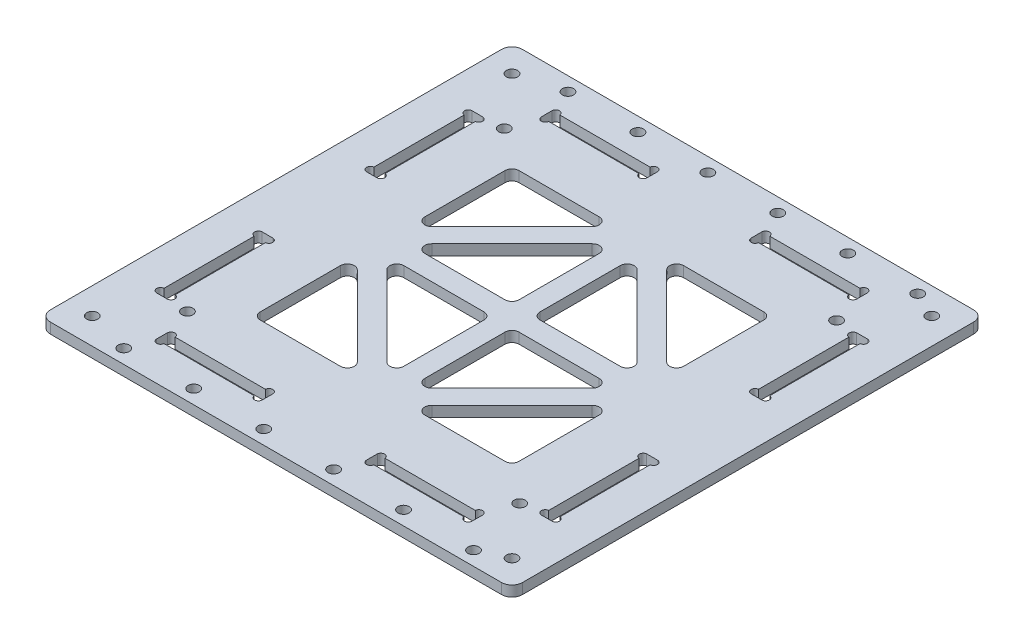
from build123d import *

# Parameters (mm, degrees)
SKETCH_1_W                         = 135
SKETCH_1_H                         = 135
SKETCH_1_R                         = 1.6
EXTRUDE_1_DEPTH                    = 3
SKETCH_2_R                         = 1.100315487
SKETCH_2_W                         = 30.2
SKETCH_2_H                         = 3.2
CUT_EXTRUDE_1_DEPTH                = 10
PATTERN_CIRCULAR_1_COUNT           = 4
PATTERN_CIRCULAR_1_COPY_1_SKETCH_R = 1.100315487
PATTERN_CIRCULAR_1_COPY_1_SKETCH_W = 30.2
PATTERN_CIRCULAR_1_COPY_1_SKETCH_H = 3.2
PATTERN_CIRCULAR_1_COPY_1_DEPTH    = 10
PATTERN_CIRCULAR_1_COPY_2_SKETCH_R = 1.100315487
PATTERN_CIRCULAR_1_COPY_2_SKETCH_W = 30.2
PATTERN_CIRCULAR_1_COPY_2_SKETCH_H = 3.2
PATTERN_CIRCULAR_1_COPY_2_DEPTH    = 10
PATTERN_CIRCULAR_1_COPY_3_SKETCH_R = 1.100315487
PATTERN_CIRCULAR_1_COPY_3_SKETCH_W = 30.2
PATTERN_CIRCULAR_1_COPY_3_SKETCH_H = 3.2
PATTERN_CIRCULAR_1_COPY_3_DEPTH    = 10
SKETCH_4_R                         = 1.6
CUT_EXTRUDE_2_DEPTH                = 10
FILLET_1_R                         = 3
CUT_EXTRUDE_3_DEPTH                = 10
FILLET_2_R                         = 2
SKETCH_6_R                         = 1.6
CUT_EXTRUDE_4_DEPTH                = 10


with BuildPart() as part:
    # 草图1 → 凸台-拉伸1 (new body)
    with BuildSketch(Plane(origin=(0, 0, 0), x_dir=(1, 0, 0), z_dir=(0, 1, 0))):
        Rectangle(SKETCH_1_W, SKETCH_1_H)
        with Locations(Location((-47.5, 45.3, 0), (0, 0, 270))):
            Circle(SKETCH_1_R, mode=Mode.SUBTRACT)
        with Locations(Location((47.5, 45.3, 0), (0, 0, 270))):
            Circle(SKETCH_1_R, mode=Mode.SUBTRACT)
        with Locations(Location((47.5, -45.3, 0), (0, 0, 270))):
            Circle(SKETCH_1_R, mode=Mode.SUBTRACT)
        with Locations(Location((-47.5, -45.3, 0), (0, 0, 270))):
            Circle(SKETCH_1_R, mode=Mode.SUBTRACT)
    extrude(amount=EXTRUDE_1_DEPTH)

    # 草图2 → 切除-拉伸1 (cut)
    with BuildSketch(Plane(origin=(0, 3, 0), x_dir=(1, 0, 0), z_dir=(0, 1, 0))):
        with Locations((-16.000315487, 56.5)):
            Circle(SKETCH_2_R)
        with Locations((-16.000315487, 53.5)):
            Circle(SKETCH_2_R)
        with Locations((-43.999684513, 56.5)):
            Circle(SKETCH_2_R)
        with Locations((-43.999684513, 53.5)):
            Circle(SKETCH_2_R)
        with Locations((-30, 55)):
            Rectangle(SKETCH_2_W, SKETCH_2_H)
    cut_extrude_1 = extrude(amount=-CUT_EXTRUDE_1_DEPTH, mode=Mode.SUBTRACT)

    # 镜向1: 切除-拉伸1 across plane
    add(cut_extrude_1.mirror(Plane(origin=(0, 0, 0), x_dir=(0, 0, 1), z_dir=(1, 0, 0))), mode=Mode.SUBTRACT)

    # 阵列(圆周)1: 切除-拉伸1 ×4 about axis
    pattern_circular_1_axis = Axis((0, 0, 0), (0, 1, 0))
    for i in range(1, PATTERN_CIRCULAR_1_COUNT):
        add(cut_extrude_1.rotate(pattern_circular_1_axis, i * 360 / PATTERN_CIRCULAR_1_COUNT), mode=Mode.SUBTRACT)

    # 阵列(圆周)1 copy 1 sketch → 阵列(圆周)1 copy 1 (cut)
    with BuildSketch(Plane.ZX.offset(3)):
        with Locations((-16.000315487, -56.5)):
            Circle(PATTERN_CIRCULAR_1_COPY_1_SKETCH_R)
        with Locations((-16.000315487, -53.5)):
            Circle(PATTERN_CIRCULAR_1_COPY_1_SKETCH_R)
        with Locations((-43.999684513, -56.5)):
            Circle(PATTERN_CIRCULAR_1_COPY_1_SKETCH_R)
        with Locations((-43.999684513, -53.5)):
            Circle(PATTERN_CIRCULAR_1_COPY_1_SKETCH_R)
        with Locations((-30, -55)):
            Rectangle(PATTERN_CIRCULAR_1_COPY_1_SKETCH_W, PATTERN_CIRCULAR_1_COPY_1_SKETCH_H)
    extrude(amount=-PATTERN_CIRCULAR_1_COPY_1_DEPTH, mode=Mode.SUBTRACT)

    # 阵列(圆周)1 copy 2 sketch → 阵列(圆周)1 copy 2 (cut)
    with BuildSketch(Plane(origin=(0, 3, 0), x_dir=(1, 0, 0), z_dir=(0, 1, 0))):
        with Locations((-16.000315487, -56.5)):
            Circle(PATTERN_CIRCULAR_1_COPY_2_SKETCH_R)
        with Locations((-16.000315487, -53.5)):
            Circle(PATTERN_CIRCULAR_1_COPY_2_SKETCH_R)
        with Locations((-43.999684513, -56.5)):
            Circle(PATTERN_CIRCULAR_1_COPY_2_SKETCH_R)
        with Locations((-43.999684513, -53.5)):
            Circle(PATTERN_CIRCULAR_1_COPY_2_SKETCH_R)
        with Locations((-30, -55)):
            Rectangle(PATTERN_CIRCULAR_1_COPY_2_SKETCH_W, PATTERN_CIRCULAR_1_COPY_2_SKETCH_H)
    extrude(amount=-PATTERN_CIRCULAR_1_COPY_2_DEPTH, mode=Mode.SUBTRACT)

    # 阵列(圆周)1 copy 3 sketch → 阵列(圆周)1 copy 3 (cut)
    with BuildSketch(Plane(origin=(0, 3, 0), x_dir=(0, 0, -1), z_dir=(0, 1, 0))):
        with Locations((-16.000315487, -56.5)):
            Circle(PATTERN_CIRCULAR_1_COPY_3_SKETCH_R)
        with Locations((-16.000315487, -53.5)):
            Circle(PATTERN_CIRCULAR_1_COPY_3_SKETCH_R)
        with Locations((-43.999684513, -56.5)):
            Circle(PATTERN_CIRCULAR_1_COPY_3_SKETCH_R)
        with Locations((-43.999684513, -53.5)):
            Circle(PATTERN_CIRCULAR_1_COPY_3_SKETCH_R)
        with Locations((-30, -55)):
            Rectangle(PATTERN_CIRCULAR_1_COPY_3_SKETCH_W, PATTERN_CIRCULAR_1_COPY_3_SKETCH_H)
    extrude(amount=-PATTERN_CIRCULAR_1_COPY_3_DEPTH, mode=Mode.SUBTRACT)

    # 草图4 → 切除-拉伸2 (cut)
    with BuildSketch(Plane(origin=(0, 3, 0), x_dir=(1, 0, 0), z_dir=(0, 1, 0))):
        with Locations(Location((-60, 60, 0), (0, 0, 270))):
            Circle(SKETCH_4_R)
        with Locations(Location((60, 60, 0), (0, 0, 270))):
            Circle(SKETCH_4_R)
        with Locations(Location((60, -60, 0), (0, 0, 270))):
            Circle(SKETCH_4_R)
        with Locations(Location((-60, -60, 0), (0, 0, 270))):
            Circle(SKETCH_4_R)
    extrude(amount=-CUT_EXTRUDE_2_DEPTH, mode=Mode.SUBTRACT)

    # 圆角1
    fillet_1_edges = [part.edges().sort_by_distance(p)[0] for p in [
        (67.5, 1.5, 67.5),
        (-67.5, 1.5, 67.5),
        (-67.5, 1.5, -67.5),
        (67.5, 1.5, -67.5),
    ]]
    fillet(fillet_1_edges, radius=FILLET_1_R)

    # 草图5 → 切除-拉伸3 (cut)
    with BuildSketch(Plane(origin=(0, 3, 0), x_dir=(1, 0, 0), z_dir=(0, 1, 0))):
        Polygon((-7.242640687, 37), (-37, 37), (-37, 7.242640687), align=None)
        Polygon((-3, 32.757359313), (-32.757359313, 3), (-3, 3), align=None)
        Polygon((7.242640687, 37), (37, 7.242640687), (37, 37), align=None)
        Polygon((3, 32.757359313), (3, 3), (32.757359313, 3), align=None)
        Polygon((-7.242640687, -37), (-37, -7.242640687), (-37, -37), align=None)
        Polygon((-3, -32.757359313), (-3, -3), (-32.757359313, -3), align=None)
        Polygon((7.242640687, -37), (37, -37), (37, -7.242640687), align=None)
        Polygon((3, -32.757359313), (32.757359313, -3), (3, -3), align=None)
    extrude(amount=-CUT_EXTRUDE_3_DEPTH, mode=Mode.SUBTRACT)

    # 圆角2
    fillet_2_edges = [part.edges().sort_by_distance(p)[0] for p in [
        (-3, 1.5, 32.757359313),
        (-32.757359313, 1.5, 3),
        (-3, 1.5, 3),
        (7.242640687, 1.5, -37),
        (37, 1.5, -37),
        (37, 1.5, -7.242640687),
        (-3, 1.5, -32.757359313),
        (-3, 1.5, -3),
        (-32.757359313, 1.5, -3),
        (3, 1.5, -32.757359313),
        (32.757359313, 1.5, -3),
        (3, 1.5, -3),
        (3, 1.5, 32.757359313),
        (3, 1.5, 3),
        (32.757359313, 1.5, 3),
        (7.242640687, 1.5, 37),
        (37, 1.5, 7.242640687),
        (37, 1.5, 37),
        (-7.242640687, 1.5, 37),
        (-37, 1.5, 37),
        (-37, 1.5, 7.242640687),
        (-7.242640687, 1.5, -37),
        (-37, 1.5, -7.242640687),
        (-37, 1.5, -37),
    ]]
    fillet(fillet_2_edges, radius=FILLET_2_R)

    # 草图6 → 切除-拉伸4 (cut)
    with BuildSketch(Plane.XZ):
        with Locations(Location((52.5, 63.5, 0), (0, 0, 270))):
            Circle(SKETCH_6_R)
        with Locations(Location((32.5, 63.5, 0), (0, 0, 270))):
            Circle(SKETCH_6_R)
        with Locations(Location((12.5, 63.5, 0), (0, 0, 270))):
            Circle(SKETCH_6_R)
        with Locations(Location((-7.5, 63.5, 0), (0, 0, 270))):
            Circle(SKETCH_6_R)
        with Locations(Location((-27.5, 63.5, 0), (0, 0, 270))):
            Circle(SKETCH_6_R)
        with Locations(Location((-47.5, 63.5, 0), (0, 0, 270))):
            Circle(SKETCH_6_R)
    cut_extrude_4 = extrude(amount=-CUT_EXTRUDE_4_DEPTH, mode=Mode.SUBTRACT)

    # 镜向2: 切除-拉伸4 across plane
    add(cut_extrude_4.mirror(Plane.XY), mode=Mode.SUBTRACT)


solid = part.part
